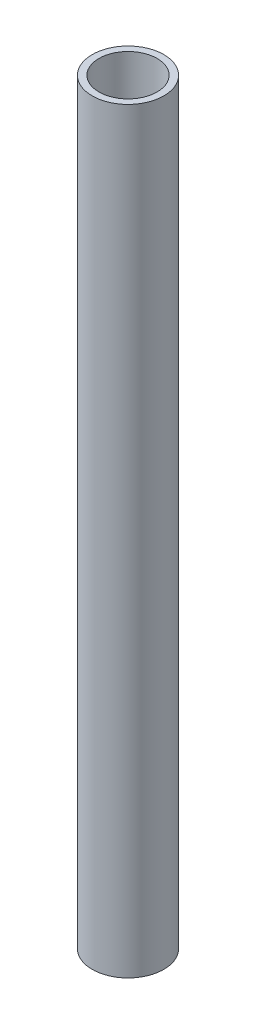
from build123d import *

# Parameters (mm, degrees)
SKETCH_1_R      = 10.65
SKETCH_1_R_2    = 8.65
EXTRUDE_1_DEPTH = 225


with BuildPart() as part:
    # Эскиз1 → Бобышка-Вытянуть1 (new body)
    with BuildSketch(Plane(origin=(0, 0, 0), x_dir=(1, 0, 0), z_dir=(0, 1, 0))):
        with Locations(Location((0, -1.5, 0), (0, 0, 90))):
            Circle(SKETCH_1_R)
        with Locations(Location((0, -1.5, 0), (0, 0, 90))):
            Circle(SKETCH_1_R_2, mode=Mode.SUBTRACT)
    extrude(amount=EXTRUDE_1_DEPTH)


solid = part.part
